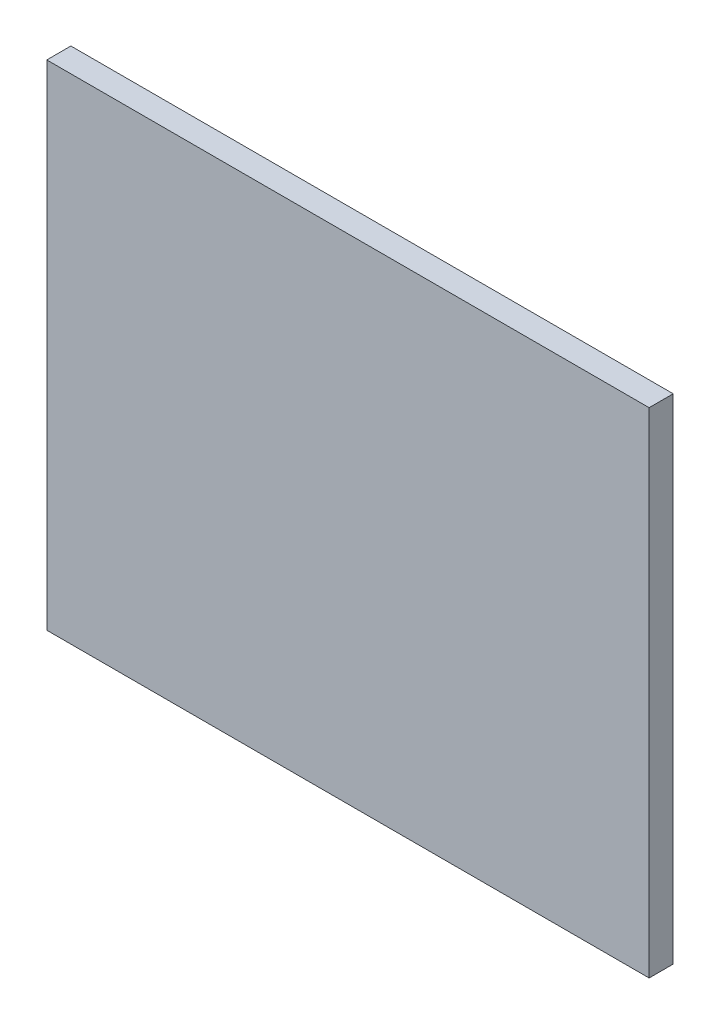
from build123d import *

# Parameters (mm, degrees)
SKETCH2_W           = 500
SKETCH2_H           = 410
BOSS_EXTRUDE1_DEPTH = 20


with BuildPart() as part:
    # Sketch2 → Boss-Extrude1 (new body)
    with BuildSketch(Plane.XY):
        with Locations((250, -205)):
            Rectangle(SKETCH2_W, SKETCH2_H)
    extrude(amount=BOSS_EXTRUDE1_DEPTH)


solid = part.part
